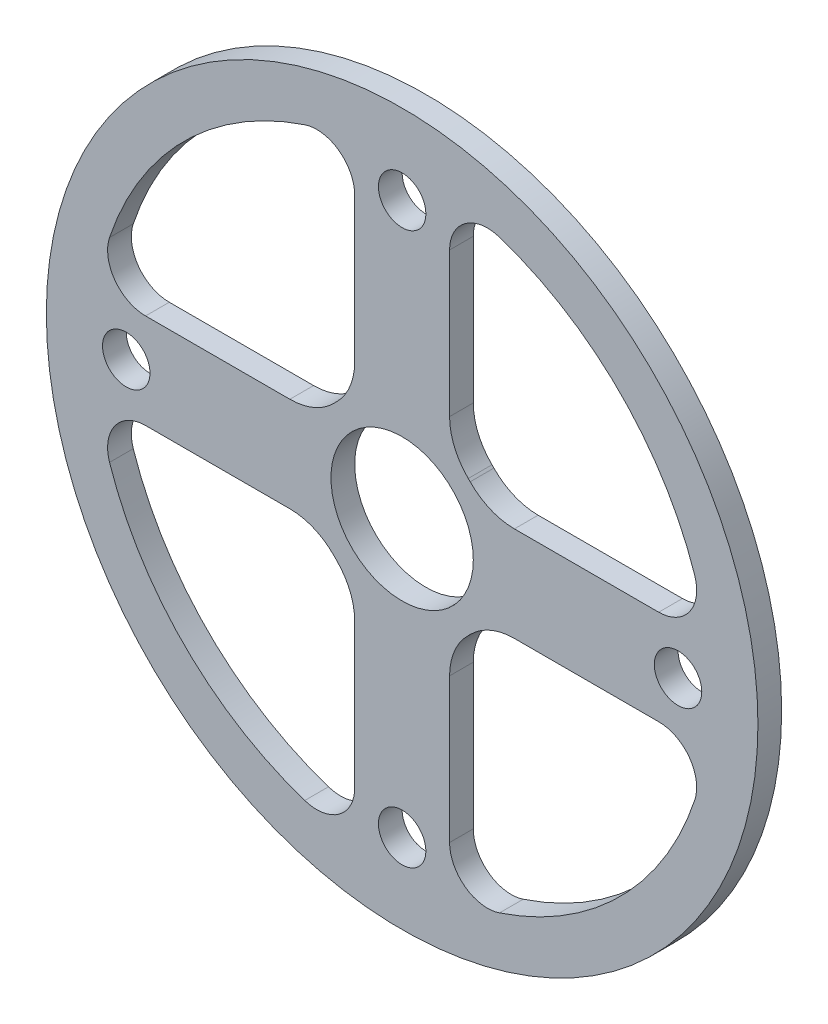
from build123d import *

# Parameters (mm, degrees)
SKETCH1_R           = 75
SKETCH1_R_2         = 15
BOSS_EXTRUDE1_DEPTH = 5
SKETCH2_R           = 5
CUT_EXTRUDE1_DEPTH  = 5
CUT_EXTRUDE2_DEPTH  = 5
FILLET1_R           = 13
FILLET2_R           = 8


with BuildPart() as part:
    # Sketch1 → Boss-Extrude1 (new body)
    with BuildSketch(Plane.XY):
        Circle(SKETCH1_R)
        Circle(SKETCH1_R_2, mode=Mode.SUBTRACT)
    extrude(amount=BOSS_EXTRUDE1_DEPTH)

    # Sketch2 → Cut-Extrude1 (cut)
    with BuildSketch(Plane.XY.offset(5)):
        with BuildLine():
            Line((-10, -64.226162893), (-10, -17.320508076))
            ThreePointArc((-10, -17.320508076), (-14.142135624, -14.142135624), (-17.320508076, -10))
            Line((-17.320508076, -10), (-64.226162893, -10))
            ThreePointArc((-64.226162893, -10), (-45.961940777, -45.961940777), (-10, -64.226162893))
        make_face()
        with BuildLine():
            ThreePointArc((10, 17.320508076), (14.142135624, 14.142135624), (17.320508076, 10))
            Line((17.320508076, 10), (64.226162893, 10))
            ThreePointArc((64.226162893, 10), (45.961940777, 45.961940777), (10, 64.226162893))
            Line((10, 64.226162893), (10, 17.320508076))
        make_face()
        with BuildLine():
            Line((-64.226162893, 10), (-17.320508076, 10))
            ThreePointArc((-17.320508076, 10), (-14.142135624, 14.142135624), (-10, 17.320508076))
            Line((-10, 17.320508076), (-10, 64.226162893))
            ThreePointArc((-10, 64.226162893), (-45.961940777, 45.961940777), (-64.226162893, 10))
        make_face()
        with Locations((58.156758338, 0)):
            Circle(SKETCH2_R)
        with Locations((0, -58.156758338)):
            Circle(SKETCH2_R)
        with Locations((-58.156758338, 0)):
            Circle(SKETCH2_R)
        with Locations((0, 58.156758338)):
            Circle(SKETCH2_R)
    extrude(amount=-CUT_EXTRUDE1_DEPTH, mode=Mode.SUBTRACT)

    # Sketch2<3> → Cut-Extrude2 (cut)
    with BuildSketch(Plane.XY.offset(5)):
        with BuildLine():
            ThreePointArc((17.320508076, -10), (14.142135624, -14.142135624), (10, -17.320508076))
            Line((10, -17.320508076), (10, -64.226162893))
            ThreePointArc((10, -64.226162893), (45.961940777, -45.961940777), (64.226162893, -10))
            Line((64.226162893, -10), (17.320508076, -10))
        make_face()
    extrude(amount=-CUT_EXTRUDE2_DEPTH, mode=Mode.SUBTRACT)

    # Fillet1
    fillet1_edges = [part.edges().sort_by_distance(p)[0] for p in [
        (10, -17.320508076, 2.5),
        (17.320508076, -10, 2.5),
        (17.320508076, 10, 2.5),
        (10, 17.320508076, 2.5),
        (-10, 17.320508076, 2.5),
        (-17.320508076, 10, 2.5),
        (-10, -17.320508076, 2.5),
        (-17.320508076, -10, 2.5),
    ]]
    fillet(fillet1_edges, radius=FILLET1_R)

    # Fillet2
    fillet2_edges = [part.edges().sort_by_distance(p)[0] for p in [
        (-64.226162893, -10, 2.5),
        (-10, -64.226162893, 2.5),
        (-64.226162893, 10, 2.5),
        (10, -64.226162893, 2.5),
        (64.226162893, -10, 2.5),
        (-10, 64.226162893, 2.5),
        (10, 64.226162893, 2.5),
        (64.226162893, 10, 2.5),
    ]]
    fillet(fillet2_edges, radius=FILLET2_R)


solid = part.part
